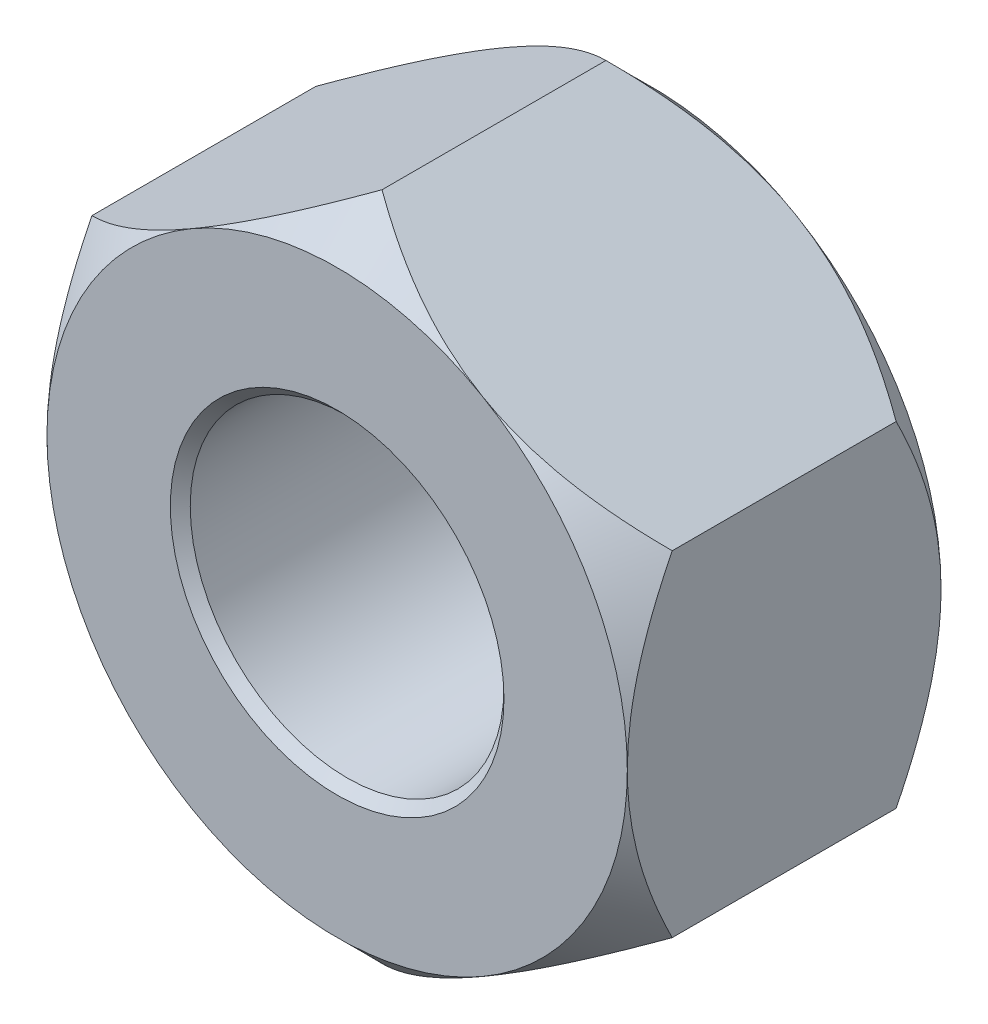
from build123d import *

# Parameters (mm, degrees)
SKETCH1_R           = 6
BOSS_EXTRUDE1_DEPTH = 6
SKETCH6_OUTSIDE_W   = 74.94
SKETCH6_OUTSIDE_H   = 78.374
SKETCH6_OUTSIDE_R   = 11.1
CUT_EXTRUDE5_DEPTH  = 21.772337374
CUT_EXTRUDE5_DRAFT  = -45
SKETCH7_OUTSIDE_W   = 74.94
SKETCH7_OUTSIDE_H   = 78.374
SKETCH7_OUTSIDE_R   = 11.1
CUT_EXTRUDE6_DEPTH  = 21.772337374
CUT_EXTRUDE6_DRAFT  = -45


with BuildPart() as part:
    # Sketch1 → Boss-Extrude1 (new, symmetric)
    with BuildSketch(Plane.XY):
        Polygon((0, -12.817175976), (11.1, -6.408587988), (11.1, 6.408587988), (0, 12.817175976), (-11.1, 6.408587988), (-11.1, -6.408587988), align=None)
        Circle(SKETCH1_R, mode=Mode.SUBTRACT)
    extrude(amount=BOSS_EXTRUDE1_DEPTH, both=True)

    # Cut-Extrude3 cone 1 section (through the dimple's axis) → Cut-Extrude3 (revolve, cut)
    with BuildSketch(Plane(origin=(0, 0, 6), x_dir=(0, -1, 0), z_dir=(1, 0, 0))):
        Polygon((0, 0), (6.381, 0), (0, 6.381), align=None)
    revolve(axis=Axis((0, 0, 6), (0, 0, -1)), mode=Mode.SUBTRACT)

    # Cut-Extrude4 cone 1 section (through the dimple's axis) → Cut-Extrude4 (revolve, cut)
    with BuildSketch(Plane(origin=(0, 0, -6), x_dir=(0, 1, 0), z_dir=(1, 0, 0))):
        Polygon((0, 0), (6.381, 0), (0, 6.381), align=None)
    revolve(axis=Axis((0, 0, -6), (0, 0, 1)), mode=Mode.SUBTRACT)


with BuildPart() as cut_extrude5_tool:
    # Sketch6 outside → Cut-Extrude5 (with draft: the straight prism first)
    with BuildSketch(Plane.XY.offset(6)):
        Rectangle(SKETCH6_OUTSIDE_W, SKETCH6_OUTSIDE_H)
        Circle(SKETCH6_OUTSIDE_R, mode=Mode.SUBTRACT)
    extrude(amount=-CUT_EXTRUDE5_DEPTH)
    # Cut-Extrude5: the draft: its side faces are tilted about the plane it starts from
    cut_extrude5_sides = [cut_extrude5_tool.faces().sort_by_distance(p)[0] for p in [
        (0, -39.187, -4.886168687),
        (37.47, 0, -4.886168687),
        (0, 39.187, -4.886168687),
        (-37.47, 0, -4.886168687),
        (-11.1, 0, -4.886168687),
    ]]
    draft(cut_extrude5_sides, Plane.XY.offset(6), CUT_EXTRUDE5_DRAFT)


with BuildPart() as part_1:
    add(part.part)

    # Cut-Extrude5: cut by cut_extrude5_tool
    add(cut_extrude5_tool.part, mode=Mode.SUBTRACT)


with BuildPart() as cut_extrude6_tool:
    # Sketch7 outside → Cut-Extrude6 (with draft: the straight prism first)
    with BuildSketch(Plane(origin=(0, 0, -6), x_dir=(-1, 0, 0), z_dir=(0, 0, -1))):
        Rectangle(SKETCH7_OUTSIDE_W, SKETCH7_OUTSIDE_H)
        Circle(SKETCH7_OUTSIDE_R, mode=Mode.SUBTRACT)
    extrude(amount=-CUT_EXTRUDE6_DEPTH)
    # Cut-Extrude6: the draft: its side faces are tilted about the plane it starts from
    cut_extrude6_sides = [cut_extrude6_tool.faces().sort_by_distance(p)[0] for p in [
        (0, -39.187, 4.886168687),
        (-37.47, 0, 4.886168687),
        (0, 39.187, 4.886168687),
        (37.47, 0, 4.886168687),
        (11.1, 0, 4.886168687),
    ]]
    draft(cut_extrude6_sides, Plane(origin=(0, 0, -6), x_dir=(-1, 0, 0), z_dir=(0, 0, -1)), CUT_EXTRUDE6_DRAFT)


with BuildPart() as part_2:
    add(part_1.part)

    # Cut-Extrude6: cut by cut_extrude6_tool
    add(cut_extrude6_tool.part, mode=Mode.SUBTRACT)


solid = part_2.part
